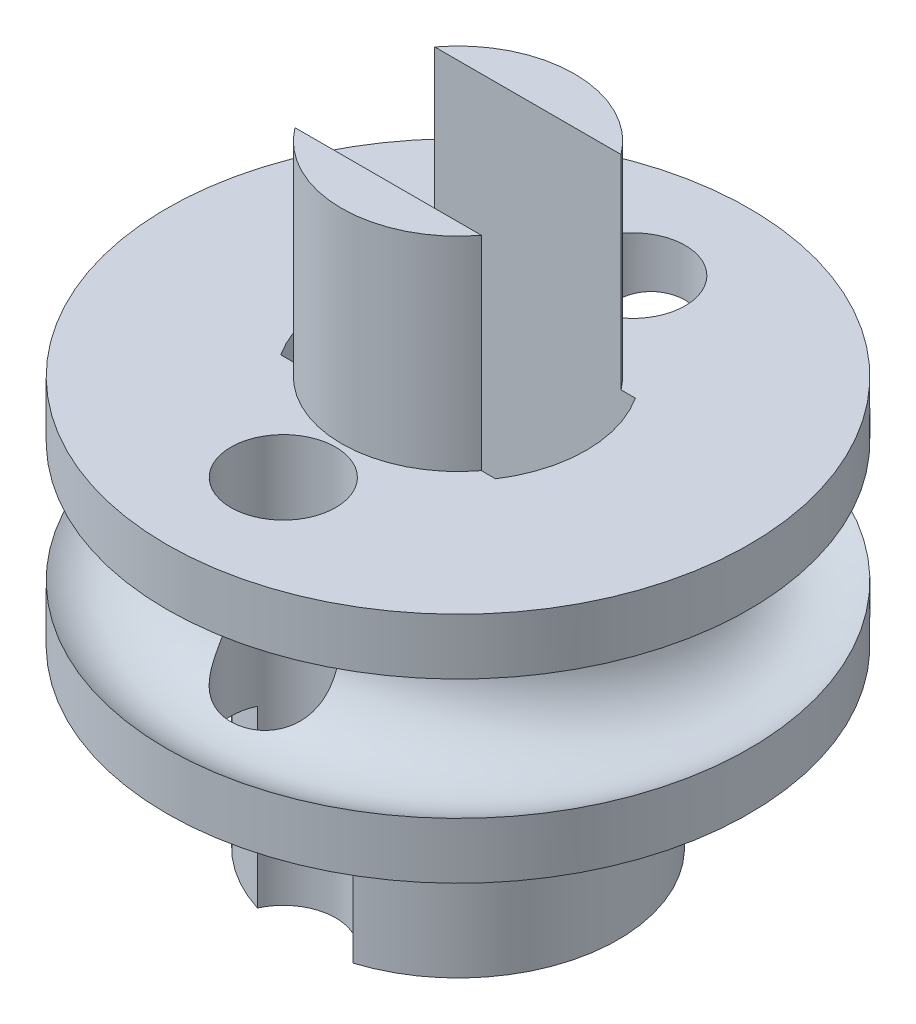
from build123d import *

# Parameters (mm, degrees)
SKETCH_1_R                      = 2.75
EXTRUDE_1_DEPTH                 = 7
CUT_EXTRUDE_1_DEPTH             = 6
EXTRUDE_2_DEPTH                 = 3.5
EXTRUDE_START                   = -4
SKETCH_5_R                      = 5
SKETCH_5_R_2                    = 2.75
EXTRUDE_3_DEPTH                 = 4
SWEEP_1_PROFILE_R               = 1.25
CUT_EXTRUDE_2_REACH             = 12.308
SKETCH_13_R                     = 0.9
CUT_EXTRUDE_2_DIRECTION_2_REACH = 12.308


with BuildPart() as part:
    # 草图1 → 凸台-拉伸1 (new body)
    with BuildSketch(Plane(origin=(0, 0, 0), x_dir=(1, 0, 0), z_dir=(0, 1, 0))):
        with Locations(Location((0, 0, 0), (0, 0, 270))):
            Circle(SKETCH_1_R)
    extrude(amount=EXTRUDE_1_DEPTH)

    # 草图2 → 切除-拉伸1 (cut)
    with BuildSketch(Plane(origin=(0, 7, 0), x_dir=(1, 0, 0), z_dir=(0, 1, 0))):
        with BuildLine():
            Line((1.843908891, 1.2), (-1.843908891, 1.2))
            ThreePointArc((-1.843908891, 1.2), (-2.2, 0), (-1.843908891, -1.2))
            Line((-1.843908891, -1.2), (1.843908891, -1.2))
            ThreePointArc((1.843908891, -1.2), (2.109099282, -0.625859584), (2.2, 0))
            ThreePointArc((2.2, 0), (2.109099282, 0.625859584), (1.843908891, 1.2))
        make_face()
    extrude(amount=-CUT_EXTRUDE_1_DEPTH, mode=Mode.SUBTRACT)

    # 草图4 → 凸台-拉伸2 (add)
    with BuildSketch(Plane(origin=(0, 7, 0), x_dir=(1, 0, 0), z_dir=(0, 1, 0))):
        with BuildLine():
            ThreePointArc((1.6, 1.2), (0, 2), (-1.6, 1.2))
            Line((-1.6, 1.2), (1.6, 1.2))
        make_face()
        with BuildLine():
            ThreePointArc((-1.6, -1.2), (0, -2), (1.6, -1.2))
            Line((1.6, -1.2), (-1.6, -1.2))
        make_face()
    extrude(amount=EXTRUDE_2_DEPTH)

    # 草图5 → 凸台-拉伸3 (add)
    with BuildSketch(Plane(origin=(0, 7, 0), x_dir=(1, 0, 0), z_dir=(0, 1, 0)).offset(EXTRUDE_START)):
        with Locations(Location((0, 0, 0), (0, 0, 270))):
            Circle(SKETCH_5_R)
        with Locations(Location((0, 0, 0), (0, 0, 270))):
            Circle(SKETCH_5_R_2, mode=Mode.SUBTRACT)
    extrude(amount=EXTRUDE_3_DEPTH)

    # 切除-扫描1: sweep along a path in 草图6
    with BuildLine(Plane(origin=(0, 5, 0), x_dir=(-1, 0, 0), z_dir=(0, -1, 0))) as sweep_1_path:
        CenterArc((0, 0), 4.3, 0, 360)
    # 切除-扫描1 profile (on start of the path) → 切除-扫描1 (sweep, cut)
    with BuildSketch(Plane(origin=(-4.3, 5, 0), x_dir=(-1, 0, 0), z_dir=(0, 0, -1))):
        Circle(SWEEP_1_PROFILE_R)
    sweep(path=sweep_1_path.line, mode=Mode.SUBTRACT)

    # 草图13 → 切除-拉伸2 (cut, up to next)
    with BuildSketch(Plane.XZ.offset(-3), mode=Mode.PRIVATE) as cut_extrude_2_sk1:
        with Locations(Location((0, 3, 0), (0, 0, 90))):
            Circle(SKETCH_13_R)
    cut_extrude_2_tool1 = extrude(cut_extrude_2_sk1.sketch, amount=-CUT_EXTRUDE_2_REACH, mode=Mode.PRIVATE) & part.part
    # 草图13 → 切除-拉伸2 (cut, up to next)
    with BuildSketch(Plane.XZ.offset(-3), mode=Mode.PRIVATE) as cut_extrude_2_sk2:
        with Locations(Location((0, -3, 0), (0, 0, 90))):
            Circle(SKETCH_13_R)
    cut_extrude_2_tool2 = extrude(cut_extrude_2_sk2.sketch, amount=-CUT_EXTRUDE_2_REACH, mode=Mode.PRIVATE) & part.part
    add(cut_extrude_2_tool1.solids().sort_by_distance((0, 3, 3))[0], mode=Mode.SUBTRACT)
    add(cut_extrude_2_tool2.solids().sort_by_distance((0, 3, -3))[0], mode=Mode.SUBTRACT)

    # 草图13 → 切除-拉伸2 direction 2 (cut, up to next)
    with BuildSketch(Plane.XZ.offset(-3), mode=Mode.PRIVATE) as cut_extrude_2_direction_2_sk1:
        with Locations(Location((0, 3, 0), (0, 0, 90))):
            Circle(SKETCH_13_R)
    cut_extrude_2_direction_2_tool1 = extrude(cut_extrude_2_direction_2_sk1.sketch, amount=CUT_EXTRUDE_2_DIRECTION_2_REACH, mode=Mode.PRIVATE) & part.part
    # 草图13 → 切除-拉伸2 direction 2 (cut, up to next)
    with BuildSketch(Plane.XZ.offset(-3), mode=Mode.PRIVATE) as cut_extrude_2_direction_2_sk2:
        with Locations(Location((0, -3, 0), (0, 0, 90))):
            Circle(SKETCH_13_R)
    cut_extrude_2_direction_2_tool2 = extrude(cut_extrude_2_direction_2_sk2.sketch, amount=CUT_EXTRUDE_2_DIRECTION_2_REACH, mode=Mode.PRIVATE) & part.part
    add(cut_extrude_2_direction_2_tool1.solids().sort_by_distance((0, 3, 3))[0], mode=Mode.SUBTRACT)
    add(cut_extrude_2_direction_2_tool2.solids().sort_by_distance((0, 3, -3))[0], mode=Mode.SUBTRACT)


solid = part.part
